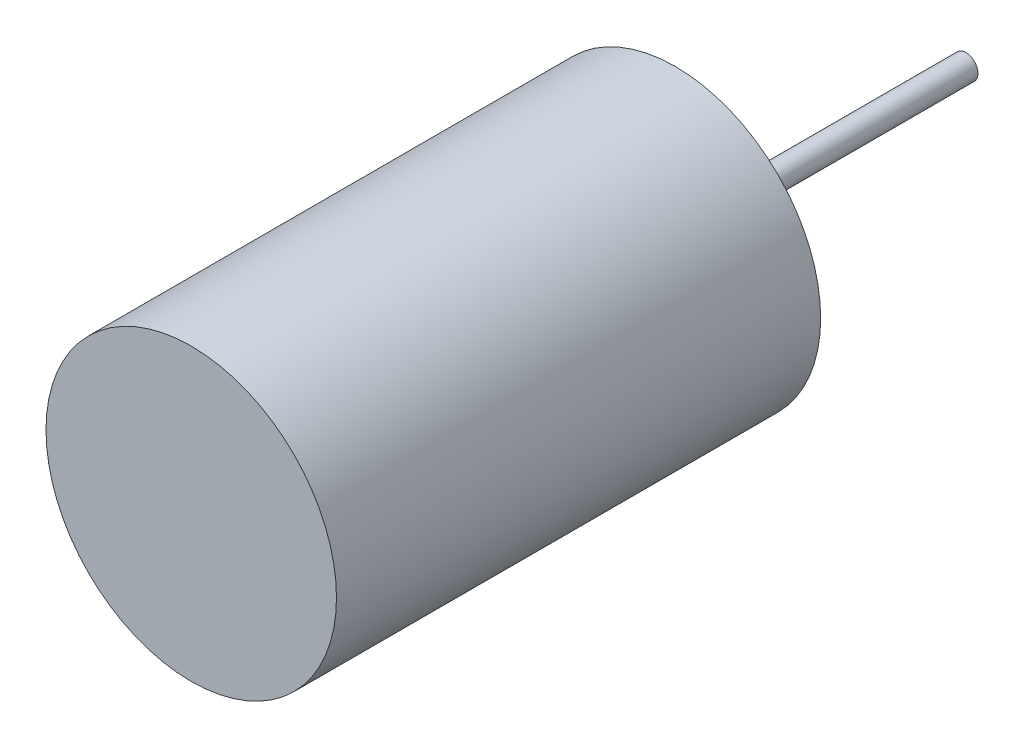
from build123d import *

# Parameters (mm, degrees)
SKETCH1_R           = 3
BOSS_EXTRUDE1_DEPTH = 10
SKETCH2_R           = 0.25
BOSS_EXTRUDE2_DEPTH = 6


with BuildPart() as part:
    # Sketch1 → Boss-Extrude1 (new body)
    with BuildSketch(Plane.XY):
        Circle(SKETCH1_R)
    extrude(amount=BOSS_EXTRUDE1_DEPTH)

    # Sketch2 → Boss-Extrude2 (add)
    with BuildSketch(Plane(origin=(0, 0, 0), x_dir=(-1, 0, 0), z_dir=(0, 0, -1))):
        with Locations(Location((0, 0, 0), (0, 0, 180))):
            Circle(SKETCH2_R)
    extrude(amount=BOSS_EXTRUDE2_DEPTH)


solid = part.part
